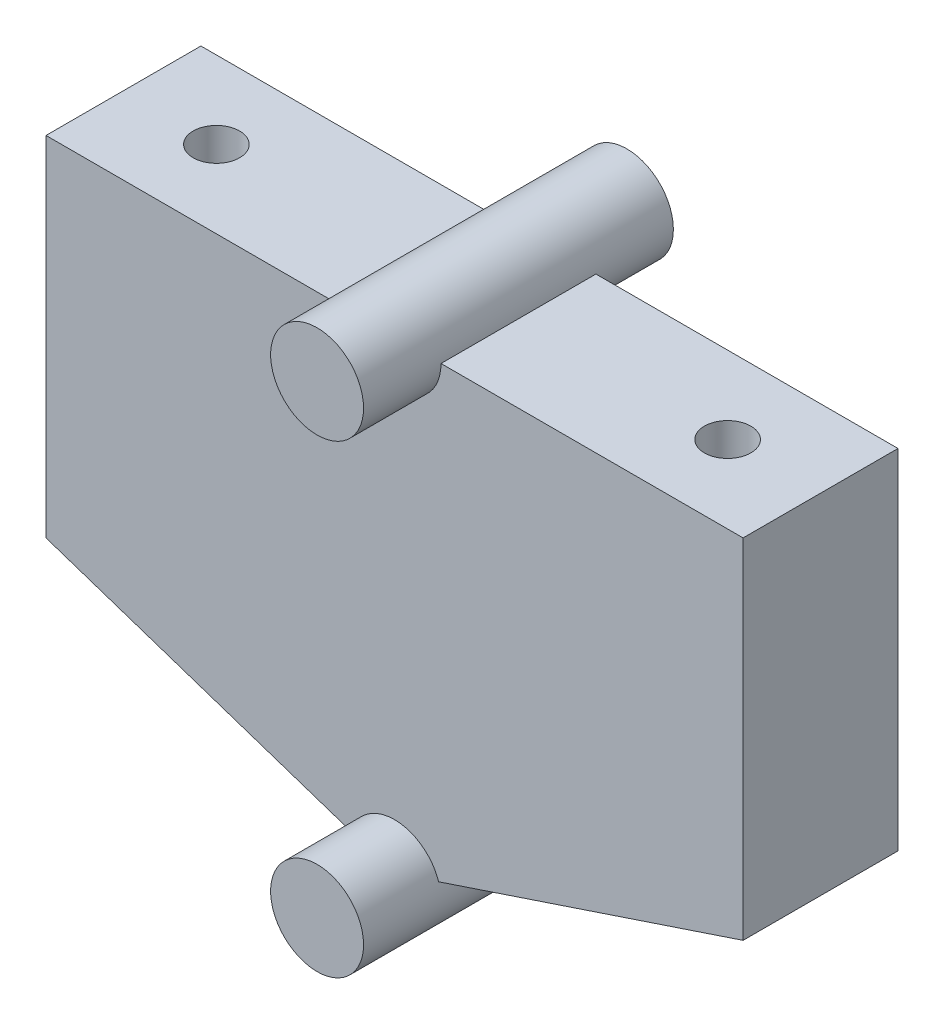
from build123d import *

# Parameters (mm, degrees)
BOSS_EXTRUDE1_DEPTH      = 10
BOSS_EXTRUDE2_DEPTH      = 15
BOSS_EXTRUDE2_DEPTH_BACK = 5
SKETCH1_3_R              = 3
SKETCH2_R                = 1.5
CUT_EXTRUDE1_DEPTH       = 43.66438796
BOSS_EXTRUDE3_DEPTH      = 5
BOSS_EXTRUDE3_DEPTH_BACK = 15
SKETCH3_R                = 3


with BuildPart() as part:
    # Sketch1 → Boss-Extrude1 (new body)
    with BuildSketch(Plane.XY):
        with BuildLine():
            ThreePointArc((-2.846049894, -17.801316702), (0, -15.75), (2.846049894, -17.801316702))
            Line((2.846049894, -17.801316702), (22.5, -11.25))
            Line((22.5, -11.25), (22.5, 11.25))
            Line((22.5, 11.25), (-22.5, 11.25))
            Line((-22.5, 11.25), (-22.5, -11.25))
            Line((-22.5, -11.25), (-2.846049894, -17.801316702))
        make_face()
    extrude(amount=BOSS_EXTRUDE1_DEPTH)

    # Sketch2 → Cut-Extrude1 (cut, through all)
    with BuildSketch(Plane(origin=(0, 11.25, 0), x_dir=(1, 0, 0), z_dir=(0, 1, 0))):
        with Locations((-16.5, -5)):
            Circle(SKETCH2_R)
        with Locations((16.5, -5)):
            Circle(SKETCH2_R)
    extrude(amount=-CUT_EXTRUDE1_DEPTH, mode=Mode.SUBTRACT)

    # Sketch3 → Boss-Extrude3 (add, two sides: drawn at the far end of the back side and taken through both)
    with BuildSketch(Plane.XY.offset(10).offset(-BOSS_EXTRUDE3_DEPTH_BACK)):
        with Locations((0, 11.25)):
            Circle(SKETCH3_R)
    extrude(amount=BOSS_EXTRUDE3_DEPTH + BOSS_EXTRUDE3_DEPTH_BACK)


with BuildPart() as body_2:
    # Sketch1<3> → Boss-Extrude2 (new, two sides: drawn at the far end of the back side and taken through both)
    with BuildSketch(Plane.XY.offset(-BOSS_EXTRUDE2_DEPTH_BACK)):
        with Locations((0, -18.75)):
            Circle(SKETCH1_3_R)
    extrude(amount=BOSS_EXTRUDE2_DEPTH + BOSS_EXTRUDE2_DEPTH_BACK)


solid = Compound([part.part, body_2.part])
